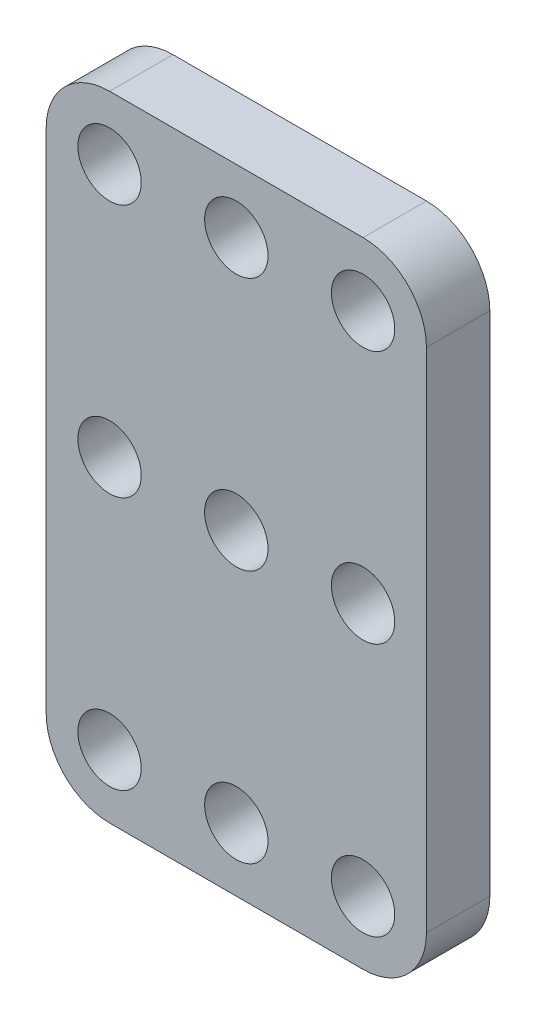
from build123d import *

# Parameters (mm, degrees)
IZIM1_W                     = 30
IZIM1_H                     = 50
IZIM1_R                     = 2.5
Y_KSEKLIK_EKSTR_ZYON1_DEPTH = 5
RADYUS1_R                   = 5


with BuildPart() as part:
    # Çizim1 → Yükseklik-Ekstrüzyon1 (new body)
    with BuildSketch(Plane.XY):
        with Locations((-49.096295608, -2.166722038)):
            Rectangle(IZIM1_W, IZIM1_H)
        with Locations((-59.096295608, 17.833277962)):
            Circle(IZIM1_R, mode=Mode.SUBTRACT)
        with Locations((-49.096295608, 17.833277962)):
            Circle(IZIM1_R, mode=Mode.SUBTRACT)
        with Locations((-39.096295608, 17.833277962)):
            Circle(IZIM1_R, mode=Mode.SUBTRACT)
        with Locations((-49.096295608, -2.166722038)):
            Circle(IZIM1_R, mode=Mode.SUBTRACT)
        with Locations((-39.096295608, -2.166722038)):
            Circle(IZIM1_R, mode=Mode.SUBTRACT)
        with Locations((-49.096295608, -22.166722038)):
            Circle(IZIM1_R, mode=Mode.SUBTRACT)
        with Locations((-39.096295608, -22.166722038)):
            Circle(IZIM1_R, mode=Mode.SUBTRACT)
        with Locations((-59.096295608, -2.166722038)):
            Circle(IZIM1_R, mode=Mode.SUBTRACT)
        with Locations((-59.096295608, -22.166722038)):
            Circle(IZIM1_R, mode=Mode.SUBTRACT)
    extrude(amount=Y_KSEKLIK_EKSTR_ZYON1_DEPTH)

    # Radyus1
    radyus1_edges = [part.edges().sort_by_distance(p)[0] for p in [
        (-64.096295608, 22.833277962, 2.5),
        (-34.096295608, 22.833277962, 2.5),
        (-34.096295608, -27.166722038, 2.5),
        (-64.096295608, -27.166722038, 2.5),
    ]]
    fillet(radyus1_edges, radius=RADYUS1_R)


solid = part.part
